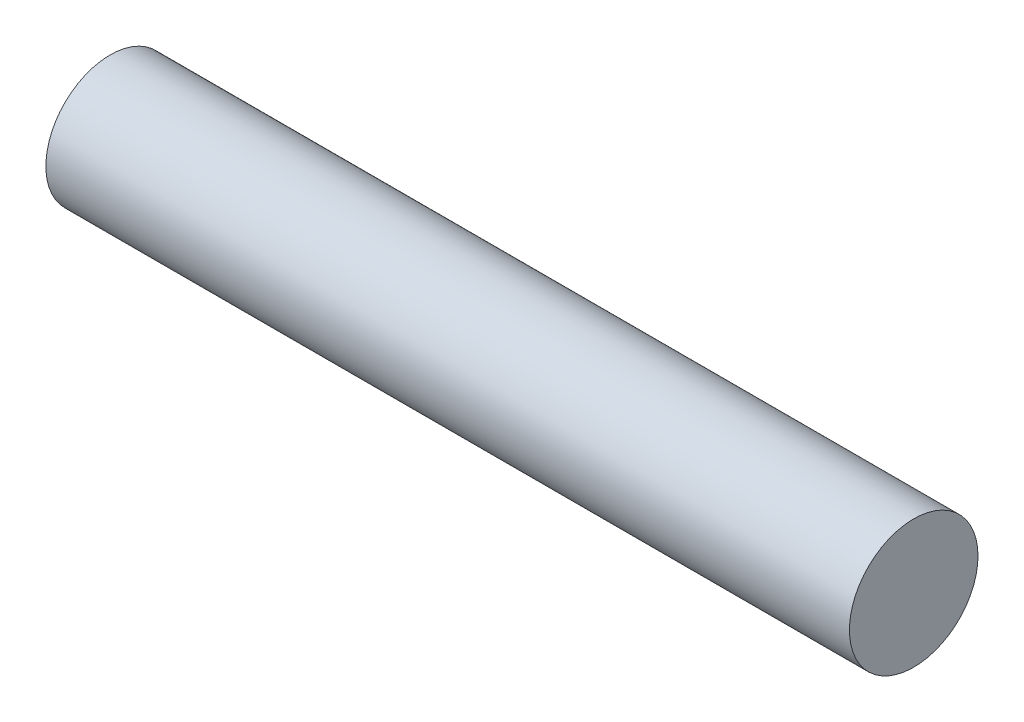
from build123d import *

# Parameters (mm, degrees)
SKETCH1_R          = 80
FOAMBODY_DEPTH     = 1000
BATTERY_START      = 10
SKETCH2_W          = 165
SKETCH2_H          = 60
BATTERY_BAY_DEPTH  = 60
FOAM_START         = 10
SKETCH3_W          = 150
SKETCH3_H          = 80
FOAM_DEPTH         = 35
BATTERY_DEPTH      = 3
BATTERY_DEPTH_BACK = 47
SKETCH4_W          = 155
SKETCH4_H          = 48
FC_START           = 13
SKETCH5_W          = 52
SKETCH5_H          = 32
FC_DEPTH           = 17


with BuildPart() as part:
    # Sketch1 → FoamBody (new body)
    with BuildSketch(Plane(origin=(0, 0, 0), x_dir=(0, 0, -1), z_dir=(1, 0, 0))):
        Circle(SKETCH1_R)
    extrude(amount=-FOAMBODY_DEPTH)

    # Sketch2 → battery bay (cut)
    with BuildSketch(Plane(origin=(0, 0, 0), x_dir=(1, 0, 0), z_dir=(0, 1, 0)).offset(BATTERY_START)):
        with Locations((-345, 0)):
            Rectangle(SKETCH2_W, SKETCH2_H)
    extrude(amount=-BATTERY_BAY_DEPTH, mode=Mode.SUBTRACT)

    # Sketch3 → Foam (cut)
    with BuildSketch(Plane(origin=(0, 0, 0), x_dir=(1, 0, 0), z_dir=(0, 1, 0)).offset(FOAM_START)):
        with Locations((-225, 0)):
            Rectangle(SKETCH3_W, SKETCH3_H)
    extrude(amount=FOAM_DEPTH, mode=Mode.SUBTRACT)


with BuildPart() as body_2:
    # Sketch4 → Battery (new, two sides: drawn at the far end of the back side and taken through both)
    with BuildSketch(Plane(origin=(0, 0, 0), x_dir=(1, 0, 0), z_dir=(0, 1, 0)).offset(-BATTERY_DEPTH_BACK)):
        with Locations((-345, 0)):
            Rectangle(SKETCH4_W, SKETCH4_H)
    extrude(amount=BATTERY_DEPTH + BATTERY_DEPTH_BACK)


with BuildPart() as body_3:
    # Sketch5 → FC (new body)
    with BuildSketch(Plane(origin=(0, 0, 0), x_dir=(1, 0, 0), z_dir=(0, 1, 0)).offset(FC_START)):
        with Locations((-225, 0)):
            Rectangle(SKETCH5_W, SKETCH5_H)
    extrude(amount=FC_DEPTH)


solid = Compound([part.part, body_2.part, body_3.part])
